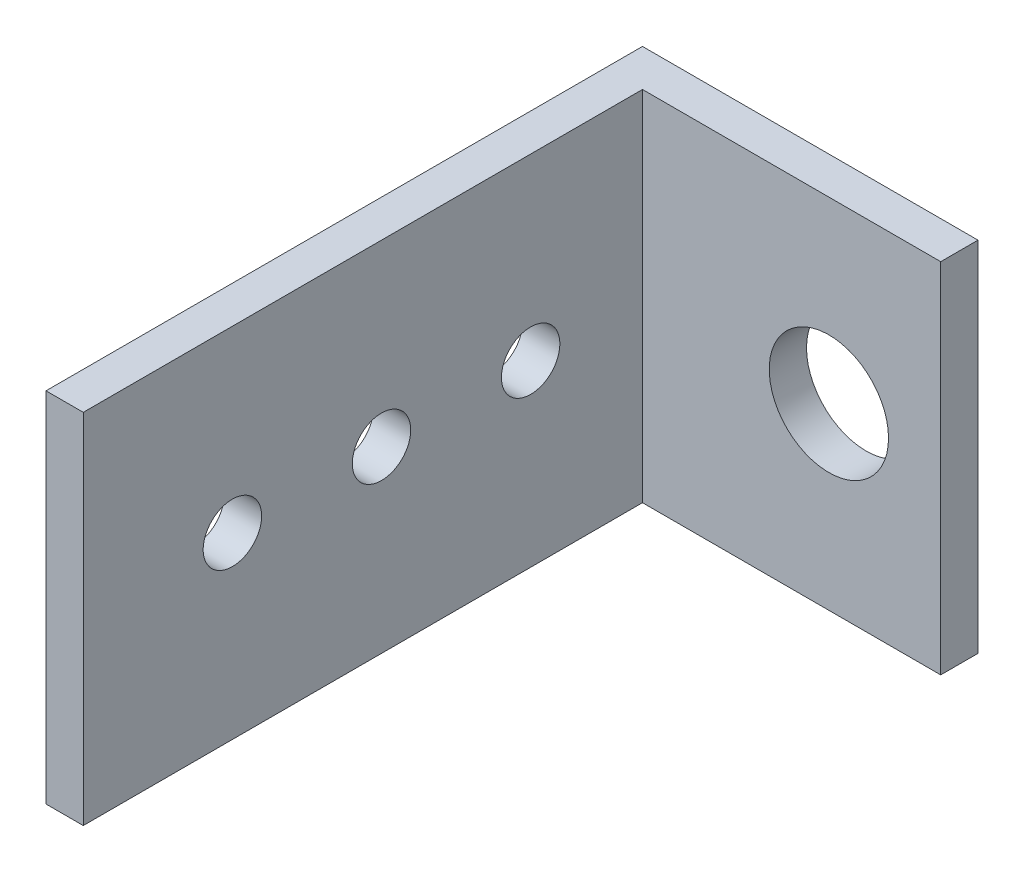
from build123d import *

# Parameters (mm, degrees)
SKETCH1_W           = 3.175
SKETCH1_H           = 47.625
SKETCH1_W_2         = 25.4
SKETCH1_H_2         = 3.175
BOSS_EXTRUDE1_DEPTH = 30.48
SKETCH2_R           = 5.08
CUT_EXTRUDE1_DEPTH  = 32.766
SKETCH3_R           = 2.4892
CUT_EXTRUDE2_DEPTH  = 32.766


with BuildPart() as part:
    # Sketch1 → Boss-Extrude1 (new body)
    with BuildSketch(Plane(origin=(0, 0, 0), x_dir=(1, 0, 0), z_dir=(0, 1, 0))):
        with Locations((1.5875, 23.8125)):
            Rectangle(SKETCH1_W, SKETCH1_H)
        with Locations((15.875, 49.2125)):
            Rectangle(SKETCH1_W_2, SKETCH1_H_2)
        with Locations((1.5875, 49.2125)):
            Rectangle(SKETCH1_W, SKETCH1_H_2)
    extrude(amount=BOSS_EXTRUDE1_DEPTH)

    # Sketch2 → Cut-Extrude1 (cut)
    with BuildSketch(Plane.XY.offset(-47.625)):
        with Locations((19.05, 15.24)):
            Circle(SKETCH2_R)
    extrude(amount=-CUT_EXTRUDE1_DEPTH, mode=Mode.SUBTRACT)

    # Sketch3 → Cut-Extrude2 (cut)
    with BuildSketch(Plane(origin=(3.175, 0, 0), x_dir=(0, 0, -1), z_dir=(1, 0, 0))):
        with Locations((12.7, 15.24)):
            Circle(SKETCH3_R)
        with Locations((25.4, 15.24)):
            Circle(SKETCH3_R)
        with Locations((38.1, 15.24)):
            Circle(SKETCH3_R)
    extrude(amount=-CUT_EXTRUDE2_DEPTH, mode=Mode.SUBTRACT)


solid = part.part
